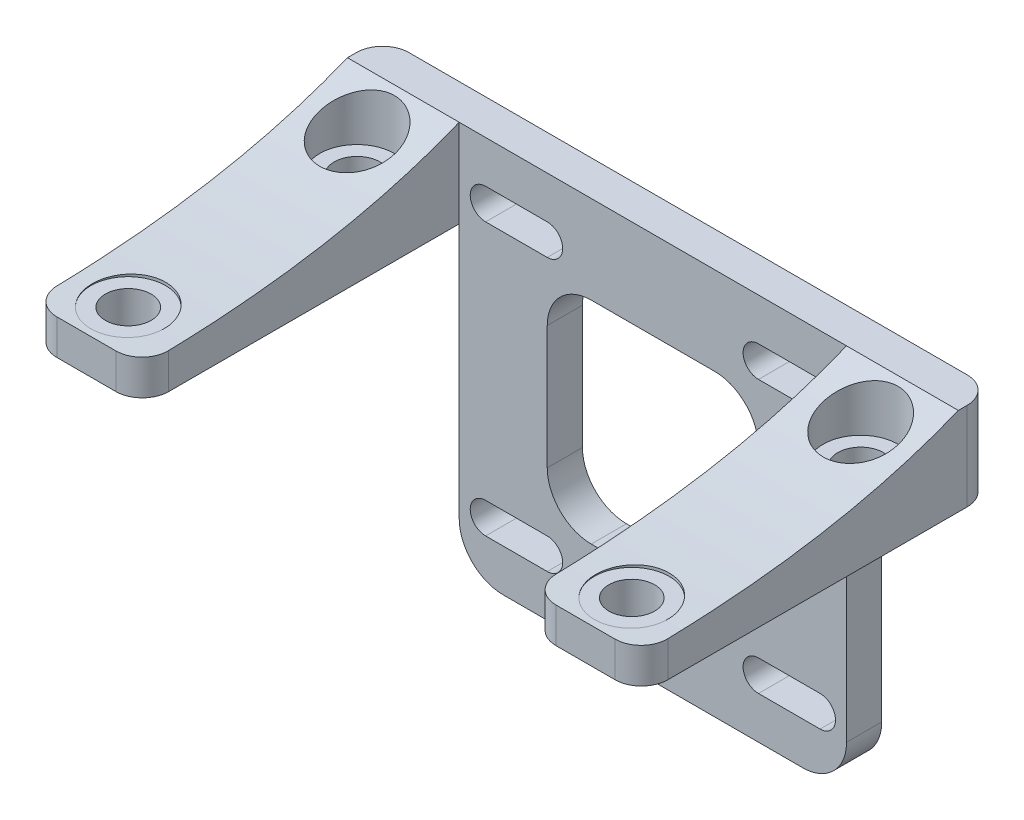
from build123d import *

# Parameters (mm, degrees)
SKETCH1_W           = 44
SKETCH1_H           = 44
BOSS_EXTRUDE1_DEPTH = 4
BOSS_EXTRUDE2_DEPTH = 12.7
SKETCH3_R           = 2.6
CUT_EXTRUDE1_DEPTH  = 63.929246102
SKETCH4_R           = 4.25
CUT_EXTRUDE2_DEPTH  = 66.177373489
FILLET1_R           = 3
FILLET2_R           = 5


with BuildPart() as part:
    # Sketch1 → Boss-Extrude1 (new body)
    with BuildSketch(Plane.XY):
        Rectangle(SKETCH1_W, SKETCH1_H)
        with BuildLine():
            Line((7, 12), (-7, 12))
            ThreePointArc((-7, 12), (-10.535533906, 10.535533906), (-12, 7))
            Line((-12, 7), (-12, -7))
            ThreePointArc((-12, -7), (-10.535533906, -10.535533906), (-7, -12))
            Line((-7, -12), (7, -12))
            ThreePointArc((7, -12), (10.535533906, -10.535533906), (12, -7))
            Line((12, -7), (12, 7))
            ThreePointArc((12, 7), (10.535533906, 10.535533906), (7, 12))
        make_face(mode=Mode.SUBTRACT)
        with BuildLine():
            Line((-19, 17.2), (-12, 17.2))
            ThreePointArc((-12, 17.2), (-10.25, 15.45), (-12, 13.7))
            Line((-12, 13.7), (-19, 13.7))
            ThreePointArc((-19, 13.7), (-20.75, 15.45), (-19, 17.2))
        make_face(mode=Mode.SUBTRACT)
        with BuildLine():
            Line((-19, -17.2), (-12, -17.2))
            ThreePointArc((-12, -17.2), (-10.25, -15.45), (-12, -13.7))
            Line((-12, -13.7), (-19, -13.7))
            ThreePointArc((-19, -13.7), (-20.75, -15.45), (-19, -17.2))
        make_face(mode=Mode.SUBTRACT)
        with BuildLine():
            Line((12, 17.2), (19, 17.2))
            ThreePointArc((19, 17.2), (20.75, 15.45), (19, 13.7))
            Line((19, 13.7), (12, 13.7))
            ThreePointArc((12, 13.7), (10.25, 15.45), (12, 17.2))
        make_face(mode=Mode.SUBTRACT)
        with BuildLine():
            Line((12, -13.7), (19, -13.7))
            ThreePointArc((19, -13.7), (20.75, -15.45), (19, -17.2))
            Line((19, -17.2), (12, -17.2))
            ThreePointArc((12, -17.2), (10.25, -15.45), (12, -13.7))
        make_face(mode=Mode.SUBTRACT)
    extrude(amount=BOSS_EXTRUDE1_DEPTH)

    # Sketch2 → Boss-Extrude2 (add)
    with BuildSketch(Plane(origin=(22, 0, 0), x_dir=(0, 0, -1), z_dir=(1, 0, 0))):
        with BuildLine():
            Line((0, 12), (-40, 12))
            Line((-40, 12), (-40, 16))
            add(Edge.make_bspline(
                [(-40, 16), (-18.32972451, 16.119369884), (-4, 22)],
                knots=[0, 0, 0, 1, 1, 1], degree=2))
            Line((-4, 22), (0, 22))
            Line((0, 22), (0, 12))
        make_face()
    boss_extrude2 = extrude(amount=BOSS_EXTRUDE2_DEPTH)

    # Sketch3 → Cut-Extrude1 (cut, through all)
    with BuildSketch(Plane.XZ.offset(-12)):
        with Locations((28.6, 35)):
            Circle(SKETCH3_R)
        with Locations((28.6, 9)):
            Circle(SKETCH3_R)
    cut_extrude1 = extrude(amount=-CUT_EXTRUDE1_DEPTH, mode=Mode.SUBTRACT)

    # Sketch4 → Cut-Extrude2 (cut, through all)
    with BuildSketch(Plane(origin=(0, 16, 0), x_dir=(-1, 0, 0), z_dir=(0, -1, 0))):
        with Locations(Location((-28.6, -9, 0), (0, 0, 180))):
            Circle(SKETCH4_R)
        with Locations(Location((-28.6, -35, 0), (0, 0, 180))):
            Circle(SKETCH4_R)
    cut_extrude2 = extrude(amount=-CUT_EXTRUDE2_DEPTH, mode=Mode.SUBTRACT)

    # Mirror1: Boss-Extrude2, Cut-Extrude1, Cut-Extrude2 across plane
    add(boss_extrude2.mirror(Plane(origin=(0, 0, 0), x_dir=(0, 0, 1), z_dir=(1, 0, 0))))
    add(cut_extrude1.mirror(Plane(origin=(0, 0, 0), x_dir=(0, 0, 1), z_dir=(1, 0, 0))), mode=Mode.SUBTRACT)
    add(cut_extrude2.mirror(Plane(origin=(0, 0, 0), x_dir=(0, 0, 1), z_dir=(1, 0, 0))), mode=Mode.SUBTRACT)

    # Fillet1
    fillet1_edges = [part.edges().sort_by_distance(p)[0] for p in [
        (34.7, 17, 0),
        (34.7, 14, 40),
        (-22, 14, 40),
        (-34.7, 17, 0),
        (-34.7, 14, 40),
        (22, 14, 40),
    ]]
    fillet(fillet1_edges, radius=FILLET1_R)

    # Fillet2
    fillet2_edges = [part.edges().sort_by_distance(p)[0] for p in [
        (22, -22, 2),
        (-22, -22, 2),
    ]]
    fillet(fillet2_edges, radius=FILLET2_R)


solid = part.part
